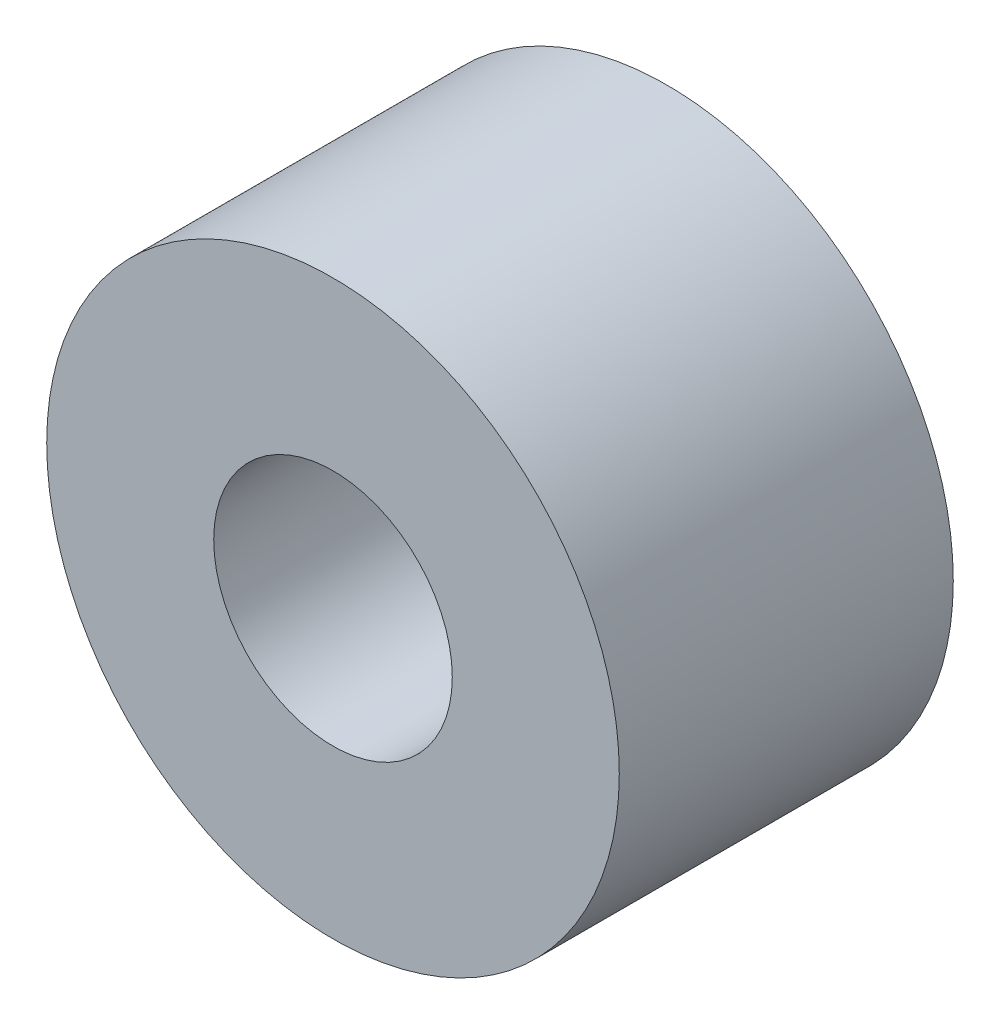
from build123d import *

# Parameters (mm, degrees)
SKETCH1_R           = 6
SKETCH1_R_2         = 2.5
BOSS_EXTRUDE1_DEPTH = 7


with BuildPart() as part:
    # Sketch1 → Boss-Extrude1 (new body)
    with BuildSketch(Plane.XY):
        Circle(SKETCH1_R)
        Circle(SKETCH1_R_2, mode=Mode.SUBTRACT)
    extrude(amount=BOSS_EXTRUDE1_DEPTH)


solid = part.part
